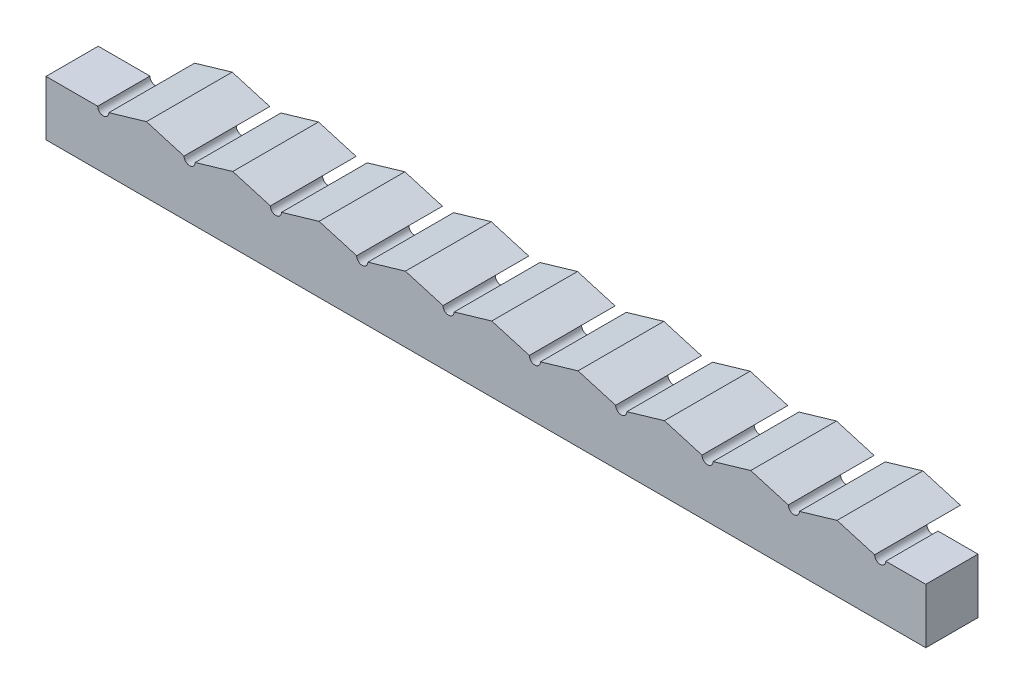
from build123d import *

# Parameters (mm, degrees)
SKETCH1_W           = 406.4
SKETCH1_H           = 25.4
BOSS_EXTRUDE1_DEPTH = 24.13
SKETCH3_R           = 2.57175
CUT_EXTRUDE1_DEPTH  = 39.624
BOSS_EXTRUDE2_DEPTH = 39.624


with BuildPart() as part:
    # Sketch1 → Boss-Extrude1 (new body)
    with BuildSketch(Plane.XY):
        with Locations((-203.2, -12.7)):
            Rectangle(SKETCH1_W, SKETCH1_H)
    extrude(amount=BOSS_EXTRUDE1_DEPTH)

    # Sketch3 → Cut-Extrude1 (cut)
    with BuildSketch(Plane.XY.offset(24.13)):
        with Locations((-379.949777658, 0)):
            Circle(SKETCH3_R)
        with Locations((-340.071777658, 0)):
            Circle(SKETCH3_R)
        with Locations((-300.193777658, 0)):
            Circle(SKETCH3_R)
        with Locations((-260.315777658, 0)):
            Circle(SKETCH3_R)
        with Locations((-220.437777658, 0)):
            Circle(SKETCH3_R)
        with Locations((-180.559777658, 0)):
            Circle(SKETCH3_R)
        with Locations((-140.681777658, 0)):
            Circle(SKETCH3_R)
        with Locations((-100.803777658, 0)):
            Circle(SKETCH3_R)
        with Locations((-60.925777658, 0)):
            Circle(SKETCH3_R)
        with Locations((-21.047777658, 0)):
            Circle(SKETCH3_R)
    extrude(amount=-CUT_EXTRUDE1_DEPTH, mode=Mode.SUBTRACT)

    # Sketch4 → Boss-Extrude2 (add)
    with BuildSketch(Plane.XY.offset(24.13)):
        Polygon((-377.378027658, 0), (-360.010777658, 5.08), (-342.643527658, 0), align=None)
        Polygon((-337.500027658, 0), (-320.132777658, 5.08), (-302.765527658, 0), align=None)
        Polygon((-297.622027658, 0), (-280.254777658, 5.08), (-262.887527658, 0), align=None)
        Polygon((-257.744027658, 0), (-240.376777658, 5.08), (-223.009527658, 0), align=None)
        Polygon((-217.866027658, 0), (-200.498777658, 5.08), (-183.131527658, 0), align=None)
        Polygon((-177.988027658, 0), (-160.620777658, 5.08), (-143.253527658, 0), align=None)
        Polygon((-138.110027658, 0), (-120.742777658, 5.08), (-103.375527658, 0), align=None)
        Polygon((-98.232027658, 0), (-80.864777658, 5.08), (-63.497527658, 0), align=None)
        Polygon((-58.354027658, 0), (-40.986777658, 5.08), (-23.619527658, 0), align=None)
    extrude(amount=-BOSS_EXTRUDE2_DEPTH)


solid = part.part
